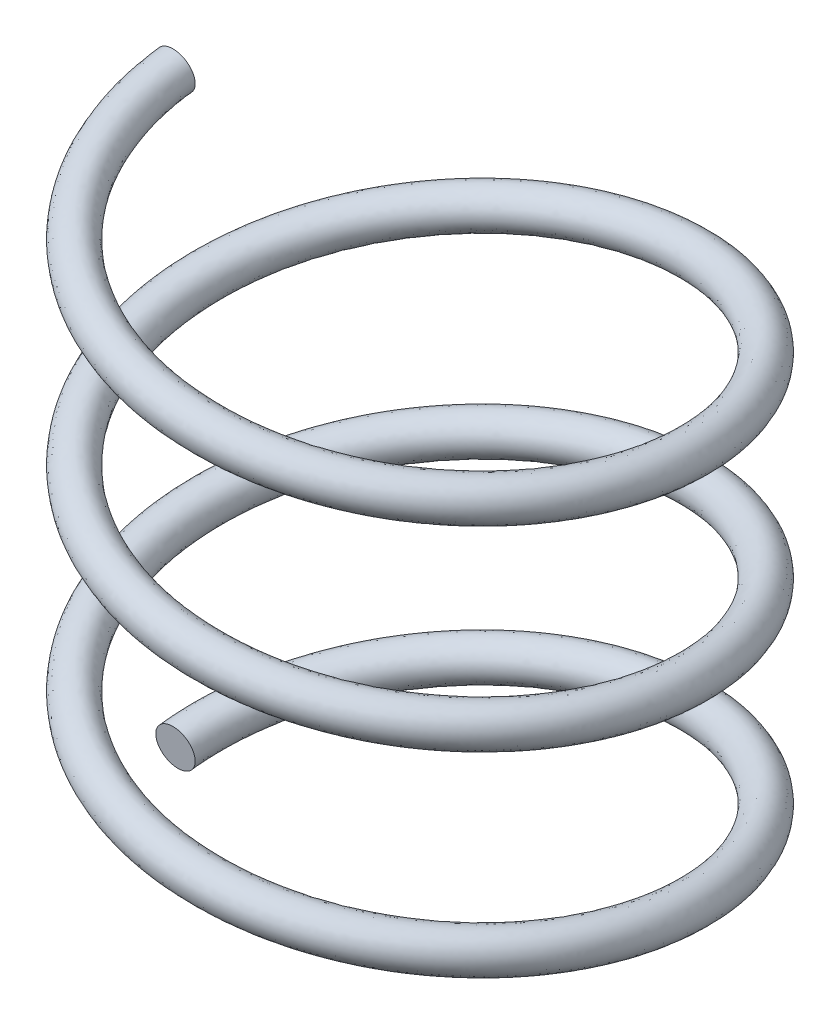
from build123d import *

# Parameters (mm, degrees)
SWEEP4_PITCH       = 10
SWEEP4_HEIGHT      = 30
SWEEP4_RADIUS      = 12.5
SWEEP4_START_ANGLE = -90
SKETCH19_R         = 1


with BuildPart() as part:
    # Sweep4: sweep along a helix
    with BuildLine() as sweep4_path:
        add(Helix(SWEEP4_PITCH, SWEEP4_HEIGHT, SWEEP4_RADIUS, center=(-0.729153954, 0, -3.181762708), direction=(0, 1, 0), lefthand=True, mode=Mode.PRIVATE).rotate(Axis((-0.729153954, 0, -3.181762708), (0, 1, 0)), SWEEP4_START_ANGLE))
    # Sketch19 → Sweep4 (sweep)
    with BuildSketch(Plane(origin=(-13.229153954, 0, -3.181762708), x_dir=(-1, 0, 0), z_dir=(-1.058373334173284e-14, 0.12630428643414296, -0.9919915459460136))):
        Circle(SKETCH19_R)
    sweep(path=sweep4_path.line, is_frenet=True)


solid = part.part
